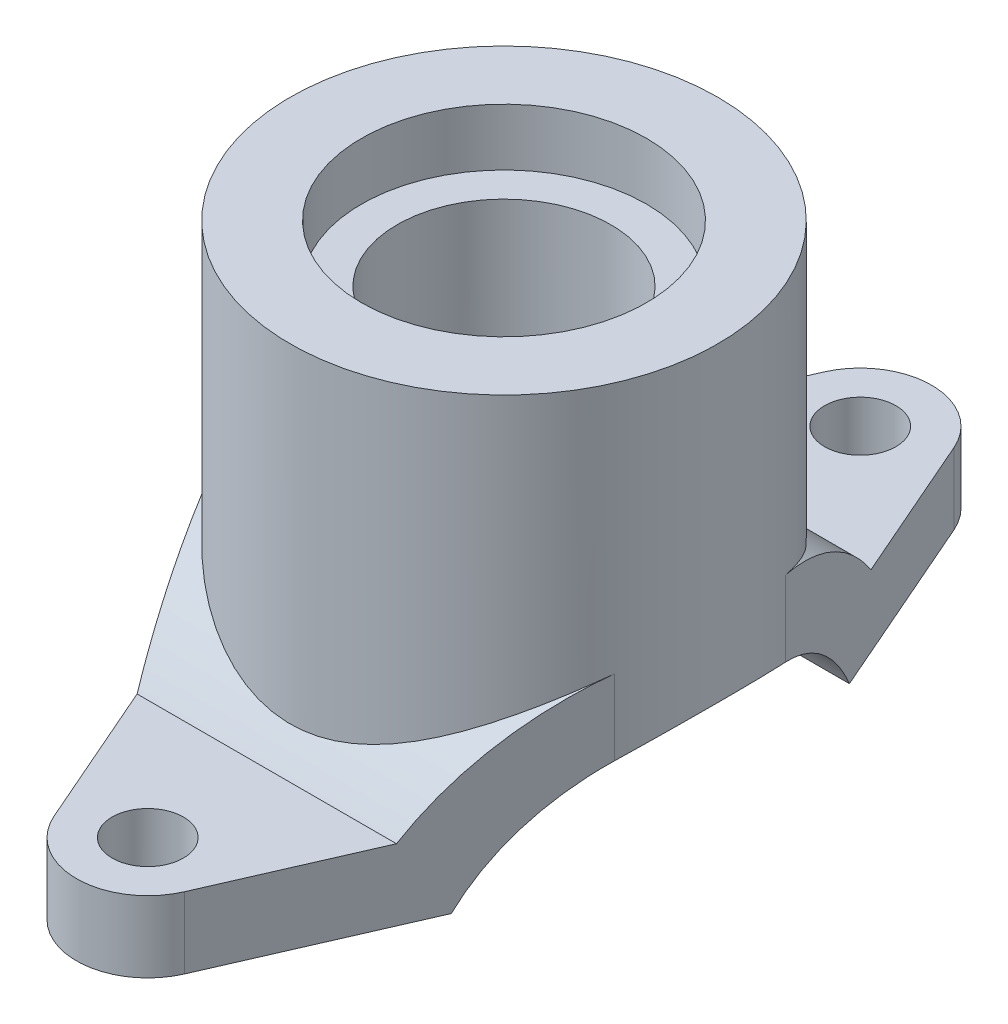
from build123d import *

# Parameters (mm, degrees)
BOSS_EXTRUDE1_DEPTH      = 150
SKETCH2_OUTSIDE_W        = 220.368
SKETCH2_OUTSIDE_H        = 370.368
SKETCH2_OUTSIDE_R        = 12.5
CUT_EXTRUDE3_DEPTH       = 150
BOSS_EXTRUDE6_REACH      = 261.808
BOSS_EXTRUDE6_END_RADIUS = 105
SKETCH5_R                = 75
SKETCH5_R_2              = 37.5
SKETCH6_R                = 50
CUT_EXTRUDE4_DEPTH       = 20


with BuildPart() as part:
    # Sketch1 → Boss-Extrude1 (new body)
    with BuildSketch(Plane(origin=(0, 0, 0), x_dir=(0, 0, -1), z_dir=(1, 0, 0))):
        with BuildLine():
            Line((83.240615087, 25), (150, 25))
            Line((150, 25), (150, 0))
            Line((150, 0), (69.84983894, 0))
            ThreePointArc((69.84983894, 0), (0, 41), (-69.84983894, 0))
            Line((-69.84983894, 0), (-150, 0))
            Line((-150, 0), (-150, 25))
            Line((-150, 25), (-83.240615087, 25))
            ThreePointArc((-83.240615087, 25), (0, 66), (83.240615087, 25))
        make_face()
    extrude(amount=-BOSS_EXTRUDE1_DEPTH)

    # Sketch2 outside → Cut-Extrude3 (cut)
    # profile 1 of 3: a face of its own
    with BuildSketch(Plane(origin=(0, 0, 0), x_dir=(1, 0, 0), z_dir=(0, 1, 0))):
        with Locations((-75, 0)):
            Rectangle(SKETCH2_OUTSIDE_W, SKETCH2_OUTSIDE_H)
        with BuildLine():
            Line((-143.738635424, 30), (-97.912878475, 135))
            ThreePointArc((-97.912878475, 135), (-75, 150), (-52.087121525, 135))
            Line((-52.087121525, 135), (-6.261364576, 30))
            ThreePointArc((-6.261364576, 30), (0, 0), (-6.261364576, -30))
            Line((-6.261364576, -30), (-52.087121525, -135))
            ThreePointArc((-52.087121525, -135), (-75, -150), (-97.912878475, -135))
            Line((-97.912878475, -135), (-143.738635424, -30))
            ThreePointArc((-143.738635424, -30), (-150, 0), (-143.738635424, 30))
        make_face(mode=Mode.SUBTRACT)
    # profile 2 of 3: a face of its own
    with BuildSketch(Plane(origin=(0, 0, 0), x_dir=(1, 0, 0), z_dir=(0, 1, 0))):
        with Locations(Location((-75, 125, 0), (0, 0, 270))):
            Circle(SKETCH2_OUTSIDE_R)
    # profile 3 of 3: a face of its own
    with BuildSketch(Plane(origin=(0, 0, 0), x_dir=(1, 0, 0), z_dir=(0, 1, 0))):
        with Locations(Location((-75, -125, 0), (0, 0, 90))):
            Circle(SKETCH2_OUTSIDE_R)
    extrude(amount=CUT_EXTRUDE3_DEPTH, mode=Mode.SUBTRACT)

    # Boss-Extrude6: up to this cylinder (the profile starts outside it)
    boss_extrude6_end = Plane(origin=(-75, -39, 0), z_dir=(1, 0, 0)) * Cylinder(BOSS_EXTRUDE6_END_RADIUS, 734.616, mode=Mode.PRIVATE)
    # Sketch5 → Boss-Extrude6 (add, up to the surface)
    with BuildSketch(Plane(origin=(0, 150, 0), x_dir=(-1, 0, 0), z_dir=(0, -1, 0)), mode=Mode.PRIVATE) as boss_extrude6_sk1:
        with Locations(Location((75, 0, 0), (0, 0, 90))):
            Circle(SKETCH5_R)
        with Locations(Location((75, 0, 0), (0, 0, 270))):
            Circle(SKETCH5_R_2, mode=Mode.SUBTRACT)
    boss_extrude6_tool1 = extrude(boss_extrude6_sk1.sketch, amount=BOSS_EXTRUDE6_REACH, mode=Mode.PRIVATE) - boss_extrude6_end
    add(boss_extrude6_tool1.solids().sort_by_distance((-75, 150, 72.87868))[0])

    # Sketch6 → Cut-Extrude4 (cut)
    with BuildSketch(Plane(origin=(0, 150, 0), x_dir=(1, 0, 0), z_dir=(0, 1, 0))):
        with Locations(Location((-75, 0, 0), (0, 0, 270))):
            Circle(SKETCH6_R)
    extrude(amount=-CUT_EXTRUDE4_DEPTH, mode=Mode.SUBTRACT)


solid = part.part
